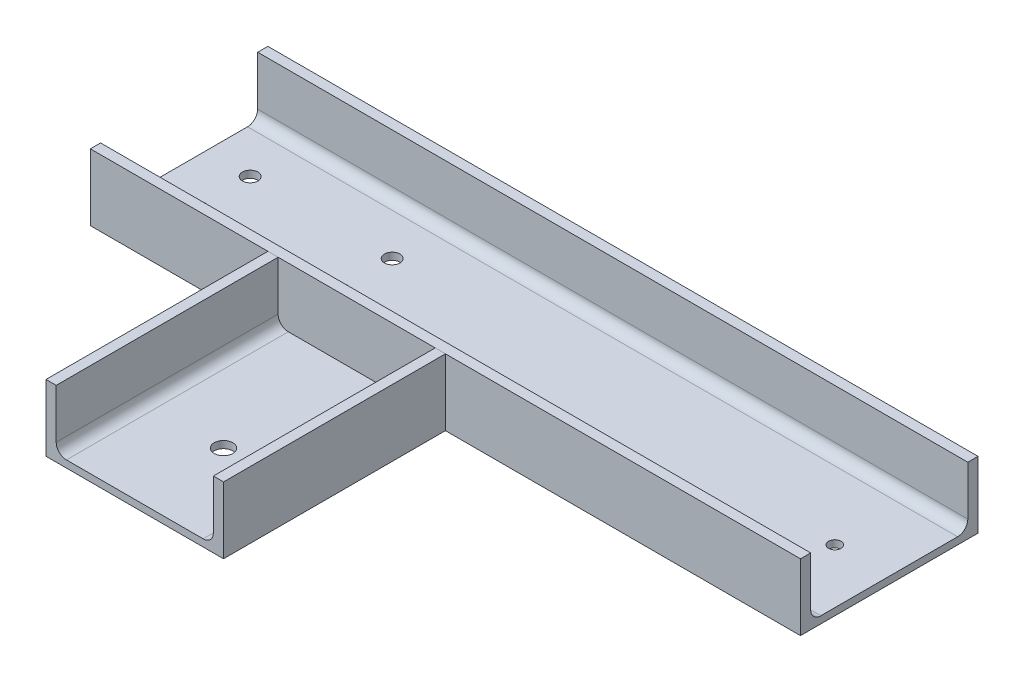
from build123d import *

# Parameters (mm, degrees)
SQUARE_HSS_AL_CS_CHANNEL_SQR_END_4_X_2_0_DEPTH = 800
SQUARE_HSS_AL_CS_CHANNEL_SQR_END_4_X_2_DEPTH   = 250
SKETCH168_W                                    = 7
SKETCH168_H                                    = 8
M20X2_5_TAPPED_HOLE1_AT_2_COUNT                = 2
M20X2_5_TAPPED_HOLE1_AT_2_PITCH                = 160
M20X2_5_TAPPED_HOLE1_AT_3_COUNT                = 2
M20X2_5_TAPPED_HOLE1_AT_3_PITCH                = 170.880074906
M20X2_5_TAPPED_HOLE1_AT_4_COUNT                = 2
M20X2_5_TAPPED_HOLE1_AT_4_PITCH                = 60


with BuildPart() as part:
    # Sketch157 → Square hss AL CS CHANNEL SQR END 4 X 2.0 (new body)
    with BuildSketch(Plane(origin=(400, 0, 0), x_dir=(0, 1, 0), z_dir=(-1, 0, 0))):
        with BuildLine():
            Line((0, 0), (0, 200))
            Line((0, 200), (75, 200))
            Line((75, 200), (75, 188.5))
            Line((75, 188.5), (19.5, 188.5))
            ThreePointArc((19.5, 188.5), (11.368272016, 185.131727984), (8, 177))
            Line((8, 177), (8, 23))
            ThreePointArc((8, 23), (11.368272016, 14.868272016), (19.5, 11.5))
            Line((19.5, 11.5), (75, 11.5))
            Line((75, 11.5), (75, 0))
            Line((75, 0), (0, 0))
        make_face()
    extrude(amount=SQUARE_HSS_AL_CS_CHANNEL_SQR_END_4_X_2_0_DEPTH)

    # Sketch168 → M16x2.0 Tapped Hole1 (revolve, cut)
    with BuildSketch(Plane(origin=(338.671963182, 8, -100), x_dir=(0, 0, 1), z_dir=(1, 0, 0))):
        with Locations((3.5, 4)):
            Rectangle(SKETCH168_W, SKETCH168_H)
    revolve(axis=Axis((338.671963182, 14.35, -100), (0, -1, 0)), mode=Mode.SUBTRACT)

    # Sketch171 → M20x2.5 Tapped Hole1 (revolve, cut)
    with BuildSketch(Plane(origin=(-350, 8, -130), x_dir=(0, 0, 1), z_dir=(1, 0, 0))):
        Polygon((0, 0), (0, 52.757530416), (8.75, 47.5), (8.75, 0), align=None)
    m20x2_5_tapped_hole1 = revolve(axis=Axis((-350, 14.35, -130), (0, -1, 0)), mode=Mode.SUBTRACT)

    # M20x2.5 Tapped Hole1 at 2: M20x2.5 Tapped Hole1 ×2
    with Locations(*[(i * M20X2_5_TAPPED_HOLE1_AT_2_PITCH, 0, 0) for i in range(1, M20X2_5_TAPPED_HOLE1_AT_2_COUNT)]):
        add(m20x2_5_tapped_hole1, mode=Mode.SUBTRACT)

    # M20x2.5 Tapped Hole1 at 3: M20x2.5 Tapped Hole1 ×2
    with Locations(*[Vector(0.9363291775690445, 1.309813106572517e-15, 0.3511234415883916) * (i * M20X2_5_TAPPED_HOLE1_AT_3_PITCH) for i in range(1, M20X2_5_TAPPED_HOLE1_AT_3_COUNT)]):
        add(m20x2_5_tapped_hole1, mode=Mode.SUBTRACT)

    # M20x2.5 Tapped Hole1 at 4: M20x2.5 Tapped Hole1 ×2
    with Locations(*[(0, 0, i * M20X2_5_TAPPED_HOLE1_AT_4_PITCH) for i in range(1, M20X2_5_TAPPED_HOLE1_AT_4_COUNT)]):
        add(m20x2_5_tapped_hole1, mode=Mode.SUBTRACT)


with BuildPart() as body_2:
    # Sketch158 → Square hss AL CS CHANNEL SQR END 4 X 2 (new body)
    with BuildSketch(Plane(origin=(0, 0, 0), x_dir=(0, 1, 0), z_dir=(0, 0, 1))):
        with BuildLine():
            Line((0, 0), (0, 200))
            Line((0, 200), (75, 200))
            Line((75, 200), (75, 188.5))
            Line((75, 188.5), (19.5, 188.5))
            ThreePointArc((19.5, 188.5), (11.368272016, 185.131727984), (8, 177))
            Line((8, 177), (8, 23))
            ThreePointArc((8, 23), (11.368272016, 14.868272016), (19.5, 11.5))
            Line((19.5, 11.5), (75, 11.5))
            Line((75, 11.5), (75, 0))
            Line((75, 0), (0, 0))
        make_face()
    extrude(amount=SQUARE_HSS_AL_CS_CHANNEL_SQR_END_4_X_2_DEPTH)

    # Sketch165 → M24x3.0 Tapped Hole1 (revolve, cut)
    with BuildSketch(Plane(origin=(-100, 8, 150), x_dir=(0, 0, 1), z_dir=(1, 0, 0))):
        Polygon((0, 0), (0, 63.3090365), (10.5, 57), (10.5, 0), align=None)
    revolve(axis=Axis((-100, 14.35, 150), (0, -1, 0)), mode=Mode.SUBTRACT)


solid = Compound([part.part, body_2.part])
